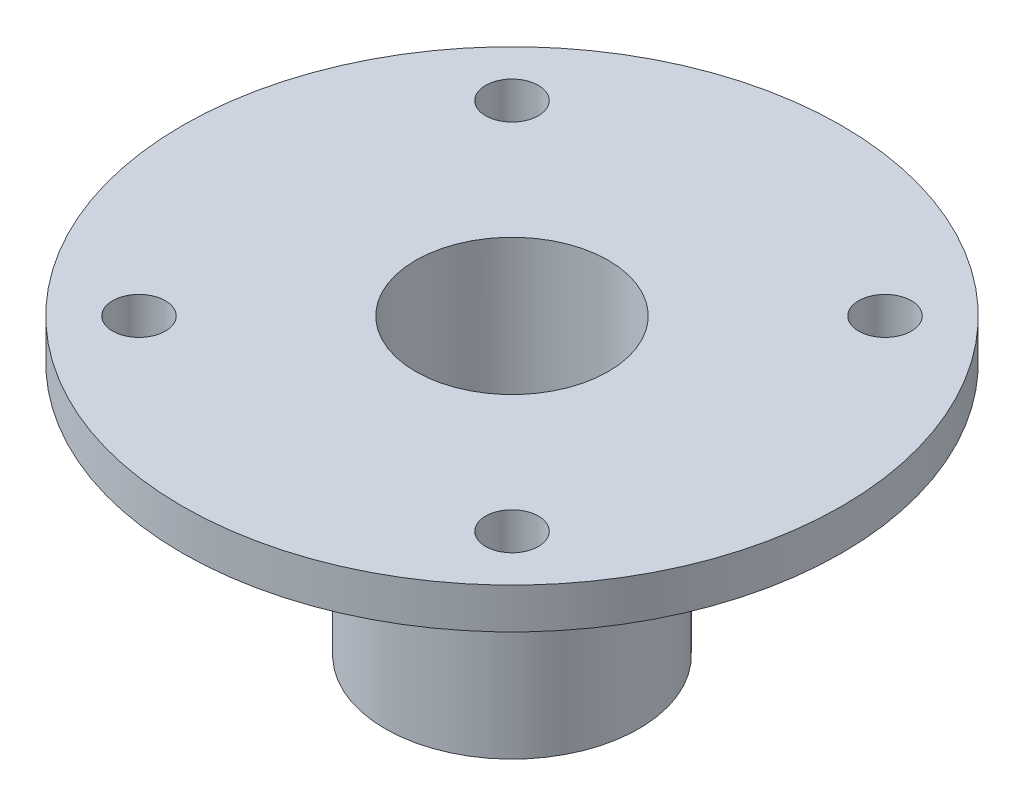
from build123d import *
from build123d.topology import SkipClean

# Parameters (mm, degrees)
SKETCH1_R           = 32.5
SKETCH1_R_2         = 9.5
SKETCH1_R_3         = 2.6
BOSS_EXTRUDE1_DEPTH = 4
BOSS_EXTRUDE2_START = 17
SKETCH2_R           = 12.5
SKETCH2_R_2         = 9.5
BOSS_EXTRUDE2_DEPTH = 17
BOSS_EXTRUDE3_START = 8
SKETCH3_R           = 12.5
BOSS_EXTRUDE3_DEPTH = 8
CUT_EXTRUDE3_REACH  = 56.346
SKETCH4_R           = 3.1
FILLET1_R           = 2


with BuildPart() as part:
    # Sketch1 → Boss-Extrude1 (new body)
    with BuildSketch(Plane(origin=(0, 0, 0), x_dir=(1, 0, 0), z_dir=(0, 1, 0))):
        with Locations(Location((0, 0, 0), (0, 0, 270))):
            Circle(SKETCH1_R)
        with Locations(Location((0, 0, 0), (0, 0, 270))):
            Circle(SKETCH1_R_2, mode=Mode.SUBTRACT)
        with Locations(Location((18.384776311, -18.384776311, 0), (0, 0, 270))):
            Circle(SKETCH1_R_3, mode=Mode.SUBTRACT)
        with Locations(Location((-18.384776311, -18.384776311, 0), (0, 0, 270))):
            Circle(SKETCH1_R_3, mode=Mode.SUBTRACT)
        with Locations(Location((-18.384776311, 18.384776311, 0), (0, 0, 270))):
            Circle(SKETCH1_R_3, mode=Mode.SUBTRACT)
        with Locations(Location((18.384776311, 18.384776311, 0), (0, 0, 270))):
            Circle(SKETCH1_R_3, mode=Mode.SUBTRACT)
    extrude(amount=BOSS_EXTRUDE1_DEPTH)

    # Sketch2 → Boss-Extrude2 (add)
    with SkipClean():  # the faces are left unmerged after this step: merging them gives an invalid solid
        with BuildSketch(Plane.XZ.offset(BOSS_EXTRUDE2_START)):
            with Locations(Location((0, 0, 0), (0, 0, 90))):
                Circle(SKETCH2_R)
            with Locations(Location((0, 0, 0), (0, 0, 270))):
                Circle(SKETCH2_R_2, mode=Mode.SUBTRACT)
        extrude(amount=-BOSS_EXTRUDE2_DEPTH)

    # Sketch3 → Boss-Extrude3 (add)
    with SkipClean():  # the faces are left unmerged after this step: merging them gives an invalid solid
        with BuildSketch(Plane.XZ.offset(17).offset(BOSS_EXTRUDE3_START)):
            with Locations(Location((0, 0, 0), (0, 0, 90))):
                Circle(SKETCH3_R)
        extrude(amount=-BOSS_EXTRUDE3_DEPTH)

    # Sketch4 → Cut-Extrude3 (cut, up to next)
    with BuildSketch(Plane.XZ.offset(25), mode=Mode.PRIVATE) as cut_extrude3_sk1:
        with Locations(Location((0, 0, 0), (0, 0, 270))):
            Circle(SKETCH4_R)
    cut_extrude3_tool1 = extrude(cut_extrude3_sk1.sketch, amount=-CUT_EXTRUDE3_REACH, mode=Mode.PRIVATE) & part.part
    add(cut_extrude3_tool1.solids().sort_by_distance((0, -25, 0))[0], mode=Mode.SUBTRACT)

    # Fillet1
    fillet1_edges = [part.edges().sort_by_distance(p)[0] for p in [
        (0, 0, -12.5),
    ]]
    fillet(fillet1_edges, radius=FILLET1_R)


solid = part.part
